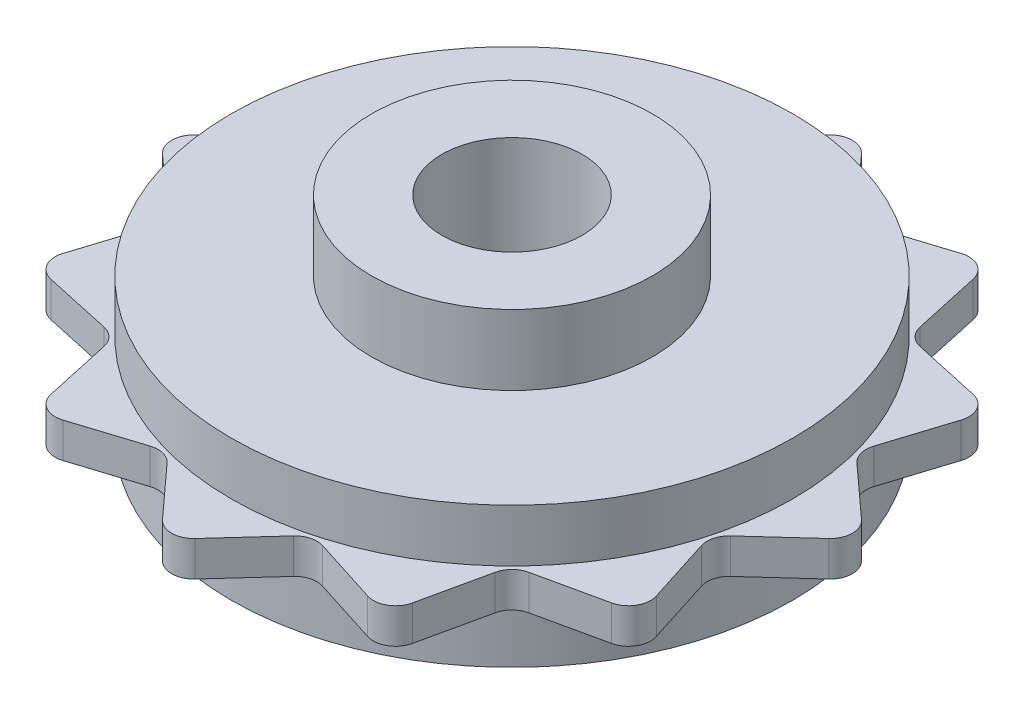
from build123d import *

# Parameters (mm, degrees)
SKETCH1_R           = 6.35
BOSS_EXTRUDE1_DEPTH = 6.35
SKETCH2_R           = 12.7
BOSS_EXTRUDE2_DEPTH = 3.175
BOSS_EXTRUDE3_DEPTH = 0.79375
CIRPATTERN1_COUNT   = 12
SKETCH4_R           = 3.175
CUT_EXTRUDE1_DEPTH  = 26.19931616


with BuildPart() as part:
    # Sketch1 → Boss-Extrude1 (new, symmetric)
    with BuildSketch(Plane(origin=(0, 0, 0), x_dir=(1, 0, 0), z_dir=(0, 1, 0))):
        with Locations(Location((0, 0, 0), (0, 0, 270))):
            Circle(SKETCH1_R)
    extrude(amount=BOSS_EXTRUDE1_DEPTH, both=True)

    # Sketch2 → Boss-Extrude2 (add, symmetric)
    with BuildSketch(Plane(origin=(0, 0, 0), x_dir=(1, 0, 0), z_dir=(0, 1, 0))):
        with Locations(Location((0, 0, 0), (0, 0, 270))):
            Circle(SKETCH2_R)
    extrude(amount=BOSS_EXTRUDE2_DEPTH, both=True)

    # Sketch3 → Boss-Extrude3 (add, symmetric)
    with BuildSketch(Plane(origin=(0, 0, 0), x_dir=(1, 0, 0), z_dir=(0, 1, 0))):
        with BuildLine():
            Line((-6.891666757, -13.415120246), (-3.89786608, -12.461780366))
            ThreePointArc((-3.89786608, -12.461780366), (-3.335621729, -12.448709767), (-2.855239137, -12.741151414))
            Line((-2.855239137, -12.741151414), (-0.739201637, -15.063668306))
            ThreePointArc((-0.739201637, -15.063668306), (-0.404051866, -15.304920203), (0, -15.390184127))
            Line((0, -15.390184127), (0, -12.7))
            Line((0, -12.7), (-6.35, -10.998522628))
            Line((-6.35, -10.998522628), (-7.695092063, -13.328290423))
            ThreePointArc((-7.695092063, -13.328290423), (-7.302540921, -13.456475632), (-6.891666757, -13.415120246))
        make_face()
    boss_extrude3 = extrude(amount=BOSS_EXTRUDE3_DEPTH, both=True)

    # CirPattern1: Boss-Extrude3 ×12 about axis
    cirpattern1_axis = Axis((0, 0, 0), (0, 1, 0))
    for i in range(1, CIRPATTERN1_COUNT):
        add(boss_extrude3.rotate(cirpattern1_axis, i * 360 / CIRPATTERN1_COUNT))

    # Sketch4 → Cut-Extrude1 (cut, through all)
    with BuildSketch(Plane(origin=(0, 6.35, 0), x_dir=(1, 0, 0), z_dir=(0, 1, 0))):
        with Locations(Location((0, 0, 0), (0, 0, 270))):
            Circle(SKETCH4_R)
    extrude(amount=-CUT_EXTRUDE1_DEPTH, mode=Mode.SUBTRACT)


solid = part.part
